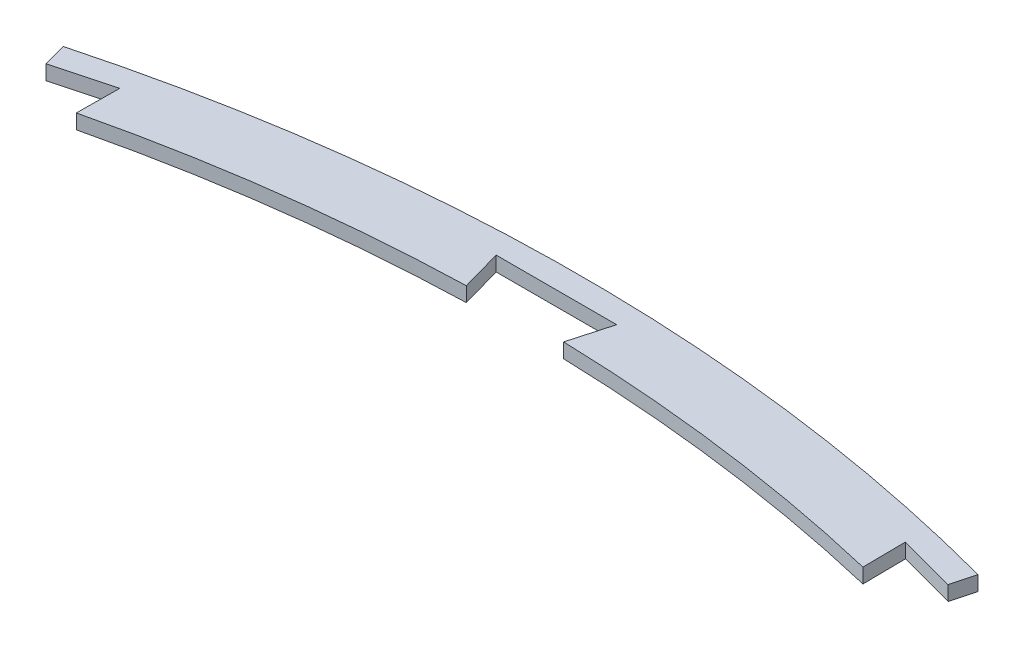
from build123d import *

# Parameters (mm, degrees)
BOSS_EXTRUDE1_DEPTH = 9


with BuildPart() as part:
    # Sketch1 → Boss-Extrude1 (new body)
    with BuildSketch(Plane(origin=(0, 0, 0), x_dir=(1, 0, 0), z_dir=(0, 1, 0))):
        with BuildLine():
            Line((-280.818663936, 1048.029521524), (-276.93637826, 1033.540634129))
            Line((-276.93637826, 1033.540634129), (-241.197122687, 1043.116938798))
            Line((-241.197122687, 1043.116938798), (-241.488127343, 1017.157059825))
            Line((-241.488127343, 1017.157059825), (-241.493100981, 1016.713372676))
            ThreePointArc((-241.493100981, 1016.713372676), (-136.39987087, 1036.059880136), (-29.880361151, 1044.572718396))
            Line((-29.880361151, 1044.572718396), (-30, 1045))
            Line((-30, 1045), (-37, 1070))
            Line((-37, 1070), (37, 1070))
            Line((37, 1070), (30, 1045))
            Line((30, 1045), (29.880361151, 1044.572718396))
            ThreePointArc((29.880361151, 1044.572718396), (136.39987087, 1036.059880136), (241.493100981, 1016.713372676))
            Line((241.493100981, 1016.713372676), (241.488127343, 1017.157059825))
            Line((241.488127343, 1017.157059825), (241.197122687, 1043.116938798))
            Line((241.197122687, 1043.116938798), (276.93637826, 1033.540634129))
            Line((276.93637826, 1033.540634129), (280.818663936, 1048.029521524))
            ThreePointArc((280.818663936, 1048.029521524), (0, 1085), (-280.818663936, 1048.029521524))
        make_face()
    extrude(amount=BOSS_EXTRUDE1_DEPTH)


solid = part.part
